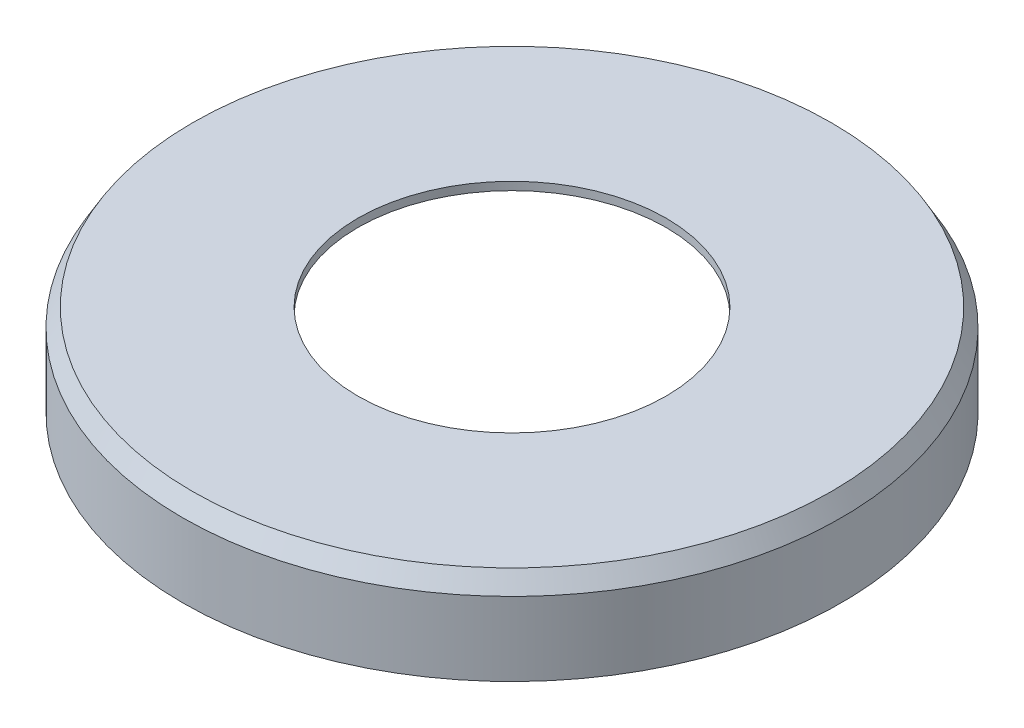
from build123d import *

# Parameters (mm, degrees)
SKETCH_1_R               = 32.5
SKETCH_1_R_2             = 28.5
EXTRUDE_1_DEPTH          = 7
SKETCH_2_R               = 32.5
EXTRUDE_2_DEPTH          = 2
SKETCH_3_R               = 29.25
CUT_EXTRUDE_1_DEPTH      = 7
EXTRUDE_3_DEPTH          = 7
PATTERN_CIRCULAR_1_COUNT = 3
CHAMFER_1_SIZE           = 1
CHAMFER_1_SIZE2          = 1.732050808
SKETCH_5_R               = 15.2
CUT_EXTRUDE_2_DEPTH      = 47.491934784
SKETCH_6_R               = 18
CUT_EXTRUDE_3_DEPTH      = 1.2


with BuildPart() as part:
    # 草图1 → 凸台-拉伸1 (new body)
    with BuildSketch(Plane(origin=(0, 0, 0), x_dir=(1, 0, 0), z_dir=(0, 1, 0))):
        with Locations(Location((0, 0, 0), (0, 0, 270))):
            Circle(SKETCH_1_R)
        with Locations(Location((0, 0, 0), (0, 0, 270))):
            Circle(SKETCH_1_R_2, mode=Mode.SUBTRACT)
    extrude(amount=EXTRUDE_1_DEPTH)

    # 草图2 → 凸台-拉伸2 (add)
    with BuildSketch(Plane(origin=(0, 7, 0), x_dir=(1, 0, 0), z_dir=(0, 1, 0))):
        with Locations(Location((0, 0, 0), (0, 0, 270))):
            Circle(SKETCH_2_R)
    extrude(amount=EXTRUDE_2_DEPTH)

    # 草图3 → 切除-拉伸1 (cut)
    with BuildSketch(Plane.XZ.offset(-7)):
        with Locations(Location((0, 0, 0), (0, 0, 90))):
            Circle(SKETCH_3_R)
    extrude(amount=CUT_EXTRUDE_1_DEPTH, mode=Mode.SUBTRACT)

    # 草图4 → 凸台-拉伸3 (add)
    with BuildSketch(Plane.XZ.offset(-7)):
        with BuildLine():
            ThreePointArc((28.04994434, -8.292353255), (27.601420816, -7.941285695), (27.528886049, -7.376342785))
            ThreePointArc((27.528886049, -7.376342785), (28.5, 0), (27.528886049, 7.376342785))
            ThreePointArc((27.528886049, 7.376342785), (27.601420816, 7.941285695), (28.04994434, 8.292353255))
            ThreePointArc((28.04994434, 8.292353255), (29.25, 0), (28.04994434, -8.292353255))
        make_face()
    extrude_3 = extrude(amount=EXTRUDE_3_DEPTH)

    # 阵列(圆周)1: 凸台-拉伸3 ×3 about axis
    pattern_circular_1_axis = Axis((0, 0, 0), (0, 1, 0))
    for i in range(1, PATTERN_CIRCULAR_1_COUNT):
        add(extrude_3.rotate(pattern_circular_1_axis, i * 360 / PATTERN_CIRCULAR_1_COUNT))

    # 倒角1
    chamfer_1_edges = [part.edges().sort_by_distance(p)[0] for p in [
        (0, 9, -32.5),
    ]]
    chamfer_1_side = [part.faces().sort_by_distance(p)[0] for p in [
        (0, 9, 0),
    ]]
    chamfer(chamfer_1_edges, length=CHAMFER_1_SIZE, length2=CHAMFER_1_SIZE2, reference=chamfer_1_side[0])

    # 草图5 → 切除-拉伸2 (cut, through all)
    with BuildSketch(Plane.XZ.offset(-7)):
        with Locations(Location((0, 0, 0), (0, 0, 270))):
            Circle(SKETCH_5_R)
    extrude(amount=-CUT_EXTRUDE_2_DEPTH, mode=Mode.SUBTRACT)

    # 草图6 → 切除-拉伸3 (cut)
    with BuildSketch(Plane.XZ.offset(-7)):
        with Locations(Location((0, 0, 0), (0, 0, 270))):
            Circle(SKETCH_6_R)
    extrude(amount=-CUT_EXTRUDE_3_DEPTH, mode=Mode.SUBTRACT)


solid = part.part
